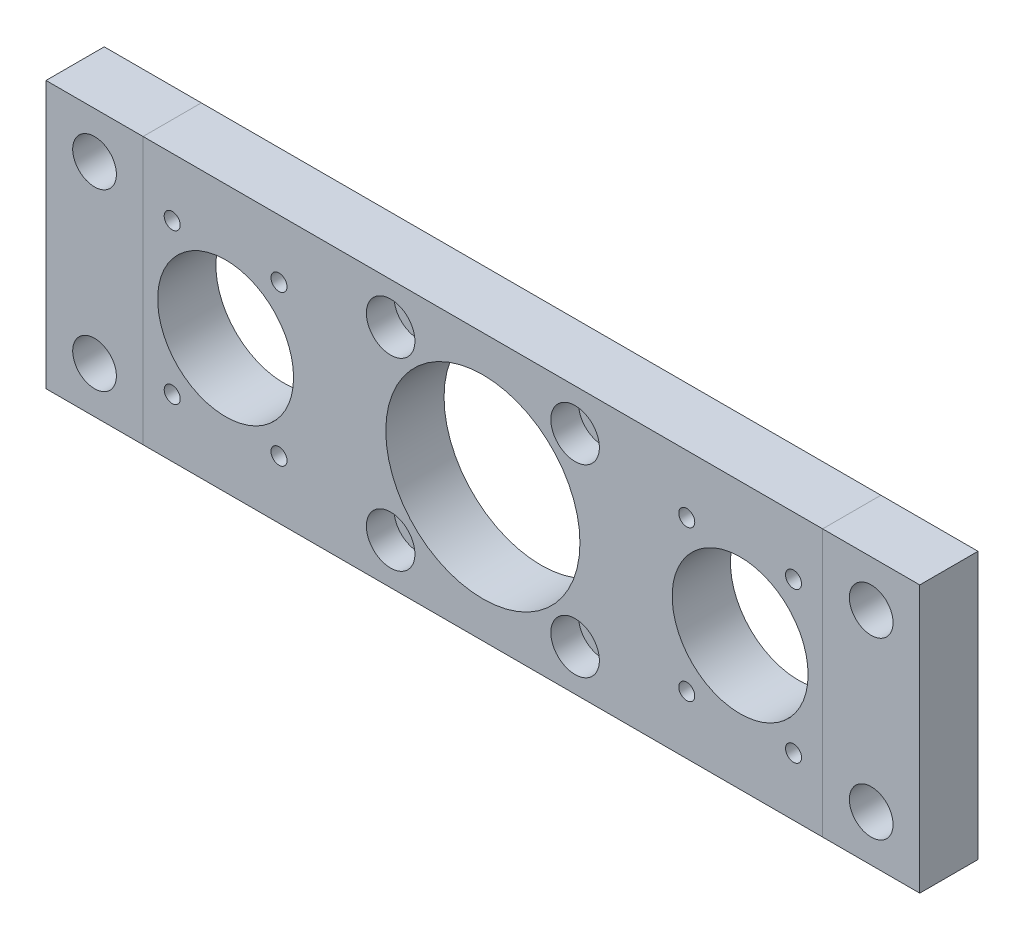
from build123d import *

# Parameters (mm, degrees)
SKETCH_1_W                = 140
SKETCH_1_H                = 55
EXTRUDE_1_DEPTH           = 12
SKETCH_2_R                = 20
SKETCH_2_R_2              = 14
CUT_EXTRUDE_1_DEPTH       = 77.159372371
HOLE_WIZARD_M4_1_D        = 3.3
HOLE_WIZARD_1_D           = 5.5
HOLE_WIZARD_1_CBORE_D     = 10
HOLE_WIZARD_1_CBORE_DEPTH = 5.7
SKETCH_10_W               = 20
SKETCH_10_H               = 55
SKETCH_10_R               = 4.5
EXTRUDE_2_DEPTH           = 12
EXTRUDE_2_2_DEPTH         = 12


with BuildPart() as part:
    # 草图1 → 凸台-拉伸1 (new body)
    with BuildSketch(Plane.XY):
        Rectangle(SKETCH_1_W, SKETCH_1_H)
    extrude(amount=EXTRUDE_1_DEPTH)

    # 草图2 → 切除-拉伸1 (cut, through all)
    with BuildSketch(Plane.XY.offset(12)):
        Circle(SKETCH_2_R)
        with Locations((-53, 0)):
            Circle(SKETCH_2_R_2)
        with Locations((53, 0)):
            Circle(SKETCH_2_R_2)
    extrude(amount=-CUT_EXTRUDE_1_DEPTH, mode=Mode.SUBTRACT)

    # M4 螺纹孔1 (through all)
    with Locations(Plane.XY.offset(12)):
        with Locations((-64, 15.5), (-42, 15.5), (-42, -15.5), (-64, -15.5), (42, -15.5), (64, -15.5), (64, 15.5), (42, 15.5)):
            Hole(HOLE_WIZARD_M4_1_D / 2)

    # 打孔尺寸(%根据)内六角圆柱头螺钉的类型1 (through all)
    with Locations(Plane.XY.offset(12)):
        with Locations((-19, 19), (19, 19), (19, -19), (-19, -19)):
            CounterBoreHole(HOLE_WIZARD_1_D / 2, HOLE_WIZARD_1_CBORE_D / 2, HOLE_WIZARD_1_CBORE_DEPTH)


with BuildPart() as body_2:
    # 草图10 → 凸台-拉伸2 (new body)
    with BuildSketch(Plane.XY.offset(12)):
        with Locations((80, 0)):
            Rectangle(SKETCH_10_W, SKETCH_10_H)
        with Locations((80, -18)):
            Circle(SKETCH_10_R, mode=Mode.SUBTRACT)
        with Locations((80, 18)):
            Circle(SKETCH_10_R, mode=Mode.SUBTRACT)
    extrude(amount=-EXTRUDE_2_DEPTH)


with BuildPart() as body_3:
    # 草图10 → Extrude 2 2 (new body)
    with BuildSketch(Plane.XY.offset(12)):
        with Locations((-80, 0)):
            Rectangle(SKETCH_10_W, SKETCH_10_H)
        with Locations((-80, 18)):
            Circle(SKETCH_10_R, mode=Mode.SUBTRACT)
        with Locations((-80, -18)):
            Circle(SKETCH_10_R, mode=Mode.SUBTRACT)
    extrude(amount=-EXTRUDE_2_2_DEPTH)


solid = Compound([part.part, body_2.part, body_3.part])
